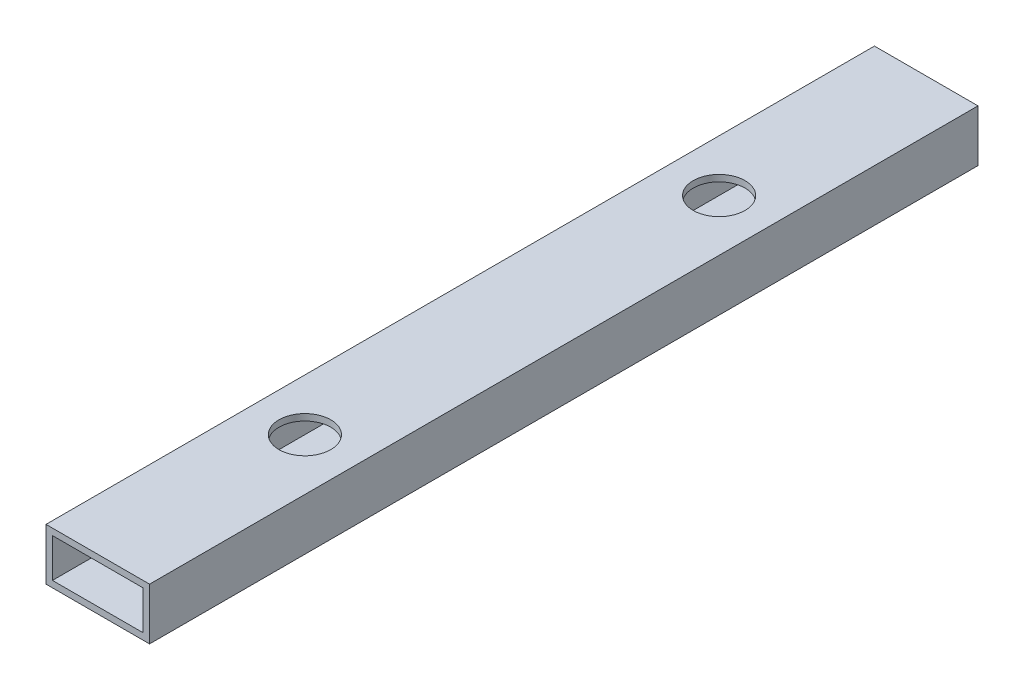
from build123d import *

# Parameters (mm, degrees)
SKETCH2_W           = 50.8
SKETCH2_H           = 25.4
SKETCH2_W_2         = 44.45
SKETCH2_H_2         = 19.05
BOSS_EXTRUDE1_DEPTH = 406.4
SKETCH3_R           = 12.7
CUT_EXTRUDE1_DEPTH  = 12.7


with BuildPart() as part:
    # Sketch2 → Boss-Extrude1 (new body)
    with BuildSketch(Plane.XY):
        with Locations((25.4, 12.7)):
            Rectangle(SKETCH2_W, SKETCH2_H)
        with Locations((25.4, 12.7)):
            Rectangle(SKETCH2_W_2, SKETCH2_H_2, mode=Mode.SUBTRACT)
    extrude(amount=BOSS_EXTRUDE1_DEPTH)

    # Sketch3 → Cut-Extrude1 (cut)
    with BuildSketch(Plane(origin=(0, 25.4, 0), x_dir=(1, 0, 0), z_dir=(0, 1, 0))):
        with Locations(Location((25.4, -101.6, 0), (0, 0, 270))):
            Circle(SKETCH3_R)
        with Locations(Location((25.4, -304.8, 0), (0, 0, 270))):
            Circle(SKETCH3_R)
    extrude(amount=-CUT_EXTRUDE1_DEPTH, mode=Mode.SUBTRACT)


solid = part.part
